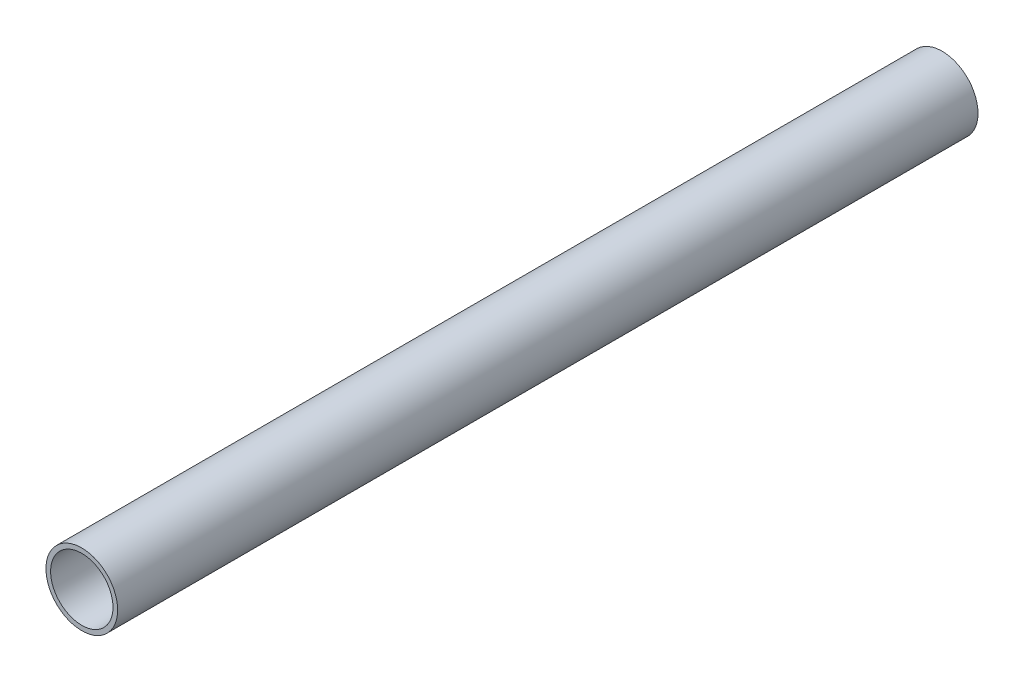
from build123d import *

# Parameters (mm, degrees)
BOSS_EXTRUDE1_DEPTH      = 152.4
BOSS_EXTRUDE1_DEPTH_BACK = 152.4
SKETCH3_R                = 12.7
SKETCH3_R_2              = 11.049


with BuildPart() as part:
    # Sketch3 → Boss-Extrude1 (new, two sides: drawn at the far end of the back side and taken through both)
    with BuildSketch(Plane.XY.offset(-BOSS_EXTRUDE1_DEPTH_BACK)):
        Circle(SKETCH3_R)
        Circle(SKETCH3_R_2, mode=Mode.SUBTRACT)
    extrude(amount=BOSS_EXTRUDE1_DEPTH + BOSS_EXTRUDE1_DEPTH_BACK)


solid = part.part
